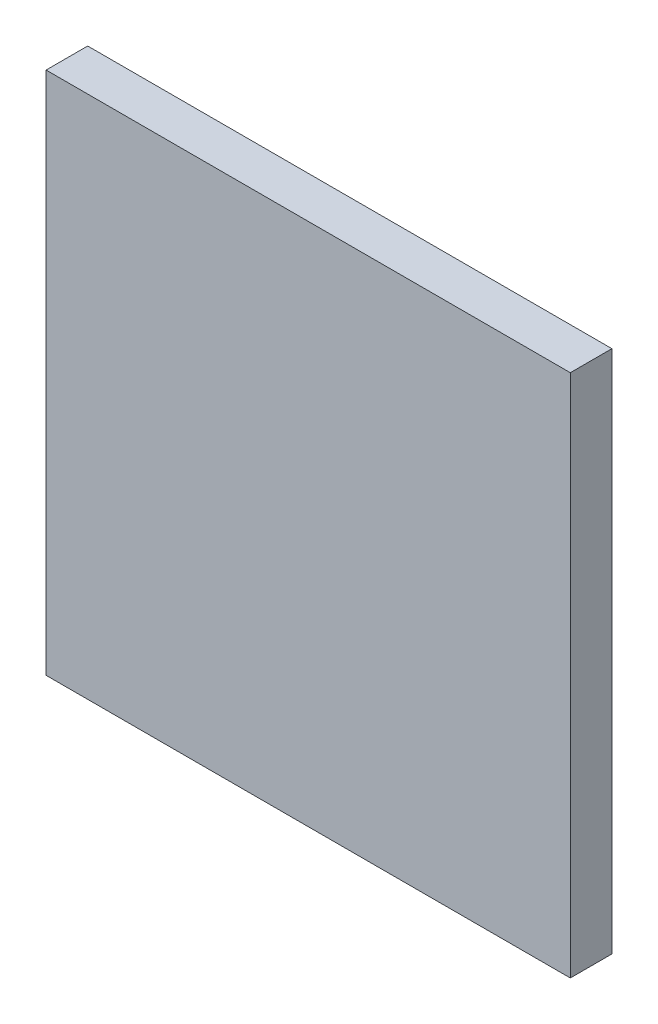
from build123d import *

# Parameters (mm, degrees)
SKIZZE1_W               = 12.5984
SKIZZE1_H               = 12.5984
COMPONENT_OUTLINE_DEPTH = 1


with BuildPart() as part:
    # Skizze1 → Component_Outline (new body)
    with BuildSketch(Plane.XY):
        Rectangle(SKIZZE1_W, SKIZZE1_H)
    extrude(amount=COMPONENT_OUTLINE_DEPTH)


solid = part.part
